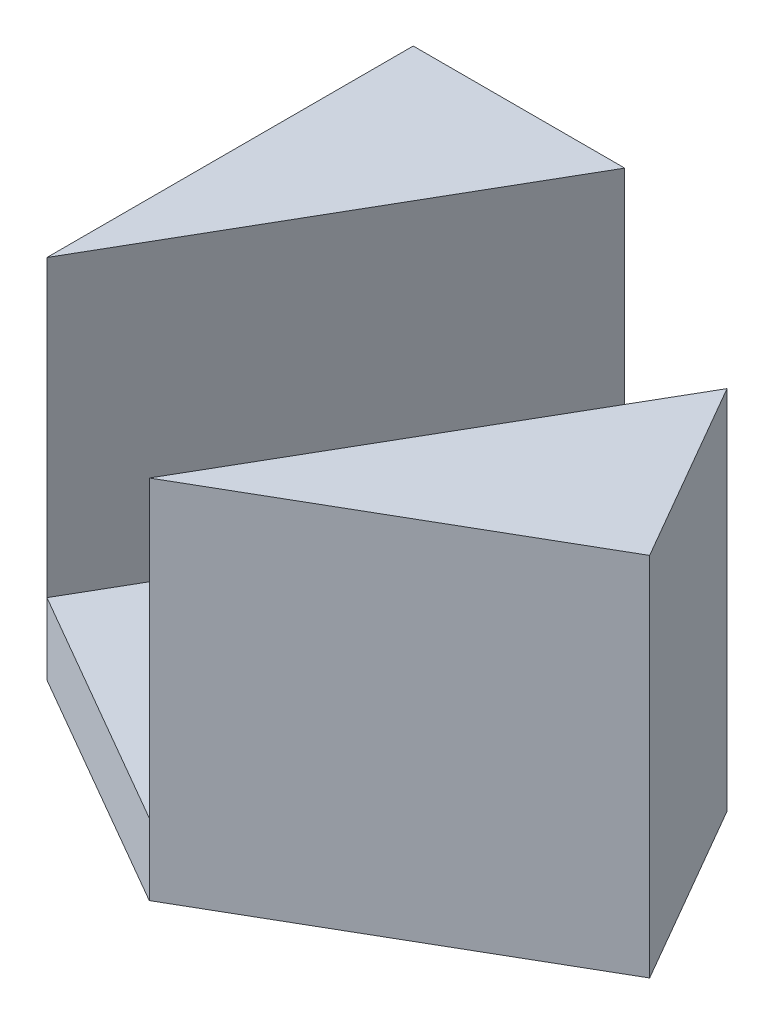
from build123d import *

# Parameters (mm, degrees)
BOSS_EXTRUDE3_DEPTH   = 15.38
BOSS_EXTRUDE3_2_DEPTH = 15.38
BOSS_EXTRUDE7_DEPTH   = 3


with BuildPart() as part:
    # Sketch1 → Boss-Extrude3 (new body)
    with BuildSketch(Plane(origin=(0, 0, 0), x_dir=(1, 0, 0), z_dir=(0, 1, 0))):
        Polygon((-108.360471904, 0), (-99.473720558, 15.392304845), (-95.030344885, 7.696152423), align=None)
    extrude(amount=BOSS_EXTRUDE3_DEPTH)


with BuildPart() as body_2:
    # Sketch1 → Boss-Extrude3 2 (new body)
    with BuildSketch(Plane(origin=(0, 0, 0), x_dir=(1, 0, 0), z_dir=(0, 1, 0))):
        Polygon((-118.536270399, 21.267304845), (-109.649519053, 21.267304845), (-118.536270399, 5.875), align=None)
    extrude(amount=BOSS_EXTRUDE3_2_DEPTH)

    # Sketch1<8> → Boss-Extrude7 (add)
    with BuildSketch(Plane(origin=(0, 0, 0), x_dir=(1, 0, 0), z_dir=(0, 1, 0))):
        Polygon((-99.473720558, 15.392304845), (-109.649519053, 21.267304845), (-118.536270399, 5.875), (-108.360471904, 0), align=None)
    extrude(amount=BOSS_EXTRUDE7_DEPTH)


solid = Compound([part.part, body_2.part])
